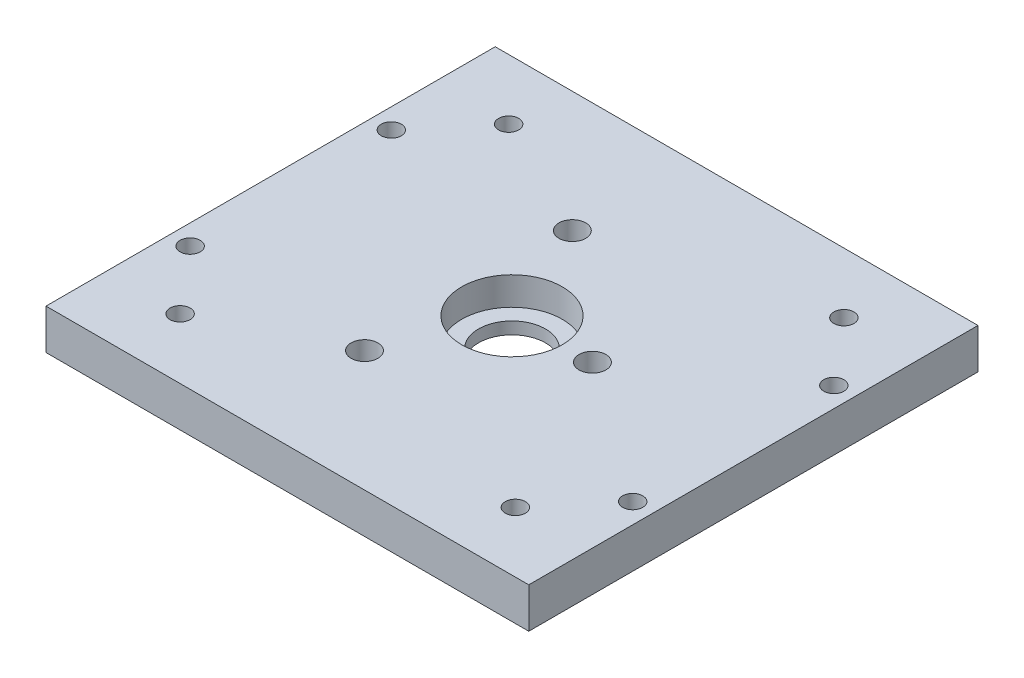
from build123d import *

# Parameters (mm, degrees)
SKETCH1_W           = 72
SKETCH1_H           = 67
BOSS_EXTRUDE1_DEPTH = 6
SKETCH2_R           = 5
SKETCH2_R_2         = 2
CUT_EXTRUDE1_DEPTH  = 6
SKETCH3_R           = 7.5
CUT_EXTRUDE2_DEPTH  = 4.2
SKETCH5_R           = 2
CUT_EXTRUDE3_DEPTH  = 10
SKETCH6_R           = 1.5
CUT_EXTRUDE4_DEPTH  = 10


with BuildPart() as part:
    # Sketch1 → Boss-Extrude1 (new body)
    with BuildSketch(Plane(origin=(0, 0, 0), x_dir=(1, 0, 0), z_dir=(0, 1, 0))):
        Rectangle(SKETCH1_W, SKETCH1_H)
    extrude(amount=BOSS_EXTRUDE1_DEPTH)

    # Sketch2 → Cut-Extrude1 (cut)
    with BuildSketch(Plane(origin=(0, 6, 0), x_dir=(1, 0, 0), z_dir=(0, 1, 0))):
        with Locations(Location((0, 0, 0), (0, 0, 270))):
            Circle(SKETCH2_R)
        with Locations(Location((-6.5, 15.5, 0), (0, 0, 270))):
            Circle(SKETCH2_R_2)
        with Locations(Location((-6.5, -15.5, 0), (0, 0, 270))):
            Circle(SKETCH2_R_2)
    extrude(amount=-CUT_EXTRUDE1_DEPTH, mode=Mode.SUBTRACT)

    # Sketch3 → Cut-Extrude2 (cut)
    with BuildSketch(Plane(origin=(0, 6, 0), x_dir=(1, 0, 0), z_dir=(0, 1, 0))):
        with Locations(Location((0, 0, 0), (0, 0, 270))):
            Circle(SKETCH3_R)
    extrude(amount=-CUT_EXTRUDE2_DEPTH, mode=Mode.SUBTRACT)

    # Sketch5 → Cut-Extrude3 (cut)
    with BuildSketch(Plane(origin=(0, 6, 0), x_dir=(1, 0, 0), z_dir=(0, 1, 0))):
        with Locations(Location((12, 0, 0), (0, 0, 270))):
            Circle(SKETCH5_R)
    extrude(amount=-CUT_EXTRUDE3_DEPTH, mode=Mode.SUBTRACT)

    # Sketch6 → Cut-Extrude4 (cut)
    with BuildSketch(Plane.XZ):
        with Locations(Location((-25, 24.5, 0), (0, 0, 270))):
            Circle(SKETCH6_R)
        with Locations(Location((25, 24.5, 0), (0, 0, 90))):
            Circle(SKETCH6_R)
        with Locations(Location((-33, 15, 0), (0, 0, 270))):
            Circle(SKETCH6_R)
        with Locations(Location((33, 15, 0), (0, 0, 90))):
            Circle(SKETCH6_R)
        with Locations(Location((33, -15, 0), (0, 0, 270))):
            Circle(SKETCH6_R)
        with Locations(Location((-33, -15, 0), (0, 0, 90))):
            Circle(SKETCH6_R)
        with Locations(Location((25, -24.5, 0), (0, 0, 270))):
            Circle(SKETCH6_R)
        with Locations(Location((-25, -24.5, 0), (0, 0, 90))):
            Circle(SKETCH6_R)
    extrude(amount=-CUT_EXTRUDE4_DEPTH, mode=Mode.SUBTRACT)


solid = part.part
